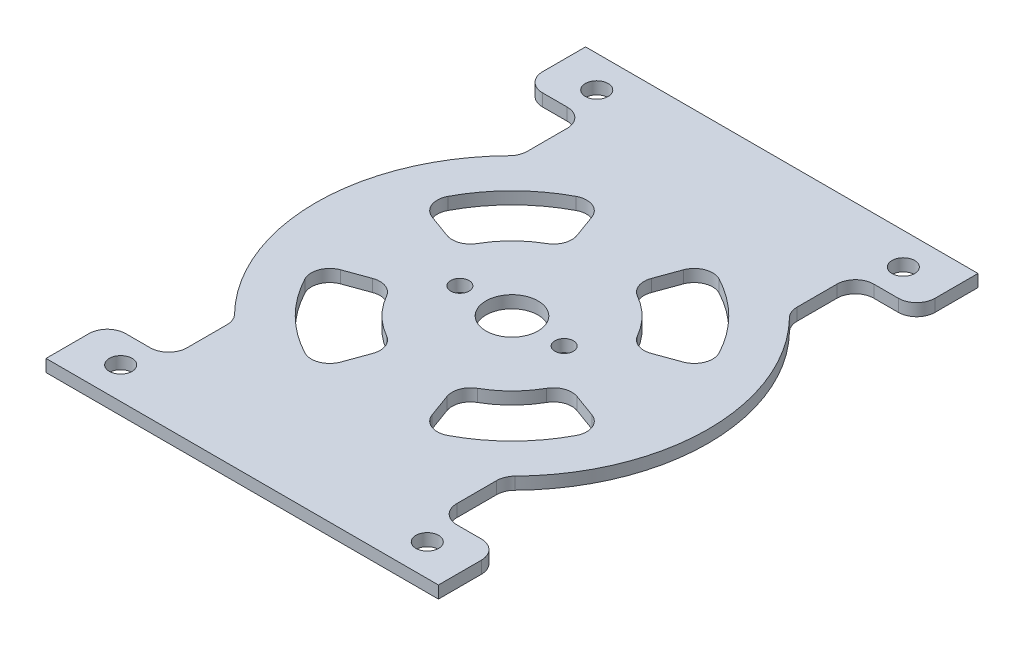
from build123d import *

# Parameters (mm, degrees)
SKETCH1_R           = 4.25
BOSS_EXTRUDE1_DEPTH = 2
CUT_EXTRUDE1_DEPTH  = 5
CIRPATTERN1_COUNT   = 4
SKETCH3_R           = 1.5
CUT_EXTRUDE2_DEPTH  = 5
SKETCH5_R           = 1.85
CUT_EXTRUDE3_DEPTH  = 5


with BuildPart() as part:
    # Sketch1 → Boss-Extrude1 (new body)
    with BuildSketch(Plane(origin=(0, 0, 0), x_dir=(1, 0, 0), z_dir=(0, 1, 0))):
        with BuildLine():
            Line((-29, -34), (-25, -34))
            ThreePointArc((-25, -34), (-22.878679656, -33.121320344), (-22, -31))
            Line((-22, -31), (-22, -24.494897428))
            ThreePointArc((-22, -24.494897428), (-22.222539701, -23.361004009), (-22.857142857, -22.395334791))
            ThreePointArc((-22.857142857, -22.395334791), (-32, 0), (-22.857142857, 22.395334791))
            ThreePointArc((-22.857142857, 22.395334791), (-22.222539701, 23.361004009), (-22, 24.494897428))
            Line((-22, 24.494897428), (-22, 31))
            ThreePointArc((-22, 31), (-22.878679656, 33.121320344), (-25, 34))
            Line((-25, 34), (-29, 34))
            ThreePointArc((-29, 34), (-31.121320344, 34.878679656), (-32, 37))
            Line((-32, 37), (-32, 44))
            Line((-32, 44), (32, 44))
            Line((32, 44), (32, 37))
            ThreePointArc((32, 37), (31.121320344, 34.878679656), (29, 34))
            Line((29, 34), (25, 34))
            ThreePointArc((25, 34), (22.878679656, 33.121320344), (22, 31))
            Line((22, 31), (22, 24.494897428))
            ThreePointArc((22, 24.494897428), (22.222539701, 23.361004009), (22.857142857, 22.395334791))
            ThreePointArc((22.857142857, 22.395334791), (32, 0), (22.857142857, -22.395334791))
            ThreePointArc((22.857142857, -22.395334791), (22.222539701, -23.361004009), (22, -24.494897428))
            Line((22, -24.494897428), (22, -31))
            ThreePointArc((22, -31), (22.878679656, -33.121320344), (25, -34))
            Line((25, -34), (29, -34))
            ThreePointArc((29, -34), (31.121320344, -34.878679656), (32, -37))
            Line((32, -37), (32, -44))
            Line((32, -44), (-32, -44))
            Line((-32, -44), (-32, -37))
            ThreePointArc((-32, -37), (-31.121320344, -34.878679656), (-29, -34))
        make_face()
        with Locations(Location((0, 0, 0), (0, 0, 270))):
            Circle(SKETCH1_R, mode=Mode.SUBTRACT)
    extrude(amount=BOSS_EXTRUDE1_DEPTH)

    # Sketch2 → Cut-Extrude1 (cut)
    with BuildSketch(Plane(origin=(0, 2, 0), x_dir=(1, 0, 0), z_dir=(0, 1, 0))):
        with BuildLine():
            ThreePointArc((-11.674129624, 22.106892534), (-9.194159134, 22.25327912), (-7.454156207, 20.48012586))
            Line((-7.454156207, 20.48012586), (-6.070255366, 16.677889548))
            ThreePointArc((-6.070255366, 16.677889548), (-6.073907786, 14.615788781), (-7.40777769, 13.043190932))
            ThreePointArc((-7.40777769, 13.043190932), (-10.606601718, 10.606601718), (-13.043190932, 7.40777769))
            ThreePointArc((-13.043190932, 7.40777769), (-14.615788781, 6.073907786), (-16.677889548, 6.070255366))
            Line((-16.677889548, 6.070255366), (-20.48012586, 7.454156207))
            ThreePointArc((-20.48012586, 7.454156207), (-22.25327912, 9.194159134), (-22.106892534, 11.674129624))
            ThreePointArc((-22.106892534, 11.674129624), (-17.67766953, 17.67766953), (-11.674129624, 22.106892534))
        make_face()
    cut_extrude1 = extrude(amount=-CUT_EXTRUDE1_DEPTH, mode=Mode.SUBTRACT)

    # CirPattern1: Cut-Extrude1 ×4 about axis
    cirpattern1_axis = Axis((0, 0, 0), (0, 1, 0))
    for i in range(1, CIRPATTERN1_COUNT):
        add(cut_extrude1.rotate(cirpattern1_axis, i * 360 / CIRPATTERN1_COUNT), mode=Mode.SUBTRACT)

    # Sketch3 → Cut-Extrude2 (cut)
    with BuildSketch(Plane(origin=(0, 2, 0), x_dir=(1, 0, 0), z_dir=(0, 1, 0))):
        with Locations(Location((-8.5, 0, 0), (0, 0, 270))):
            Circle(SKETCH3_R)
        with Locations(Location((8.5, 0, 0), (0, 0, 270))):
            Circle(SKETCH3_R)
    extrude(amount=-CUT_EXTRUDE2_DEPTH, mode=Mode.SUBTRACT)

    # Sketch5 → Cut-Extrude3 (cut)
    with BuildSketch(Plane(origin=(0, 2, 0), x_dir=(1, 0, 0), z_dir=(0, 1, 0))):
        with Locations(Location((25, 38.82, 0), (0, 0, 270))):
            Circle(SKETCH5_R)
        with Locations(Location((-25, 38.82, 0), (0, 0, 270))):
            Circle(SKETCH5_R)
        with Locations(Location((-25, -38.82, 0), (0, 0, 270))):
            Circle(SKETCH5_R)
        with Locations(Location((25, -38.82, 0), (0, 0, 270))):
            Circle(SKETCH5_R)
    extrude(amount=-CUT_EXTRUDE3_DEPTH, mode=Mode.SUBTRACT)


solid = part.part
